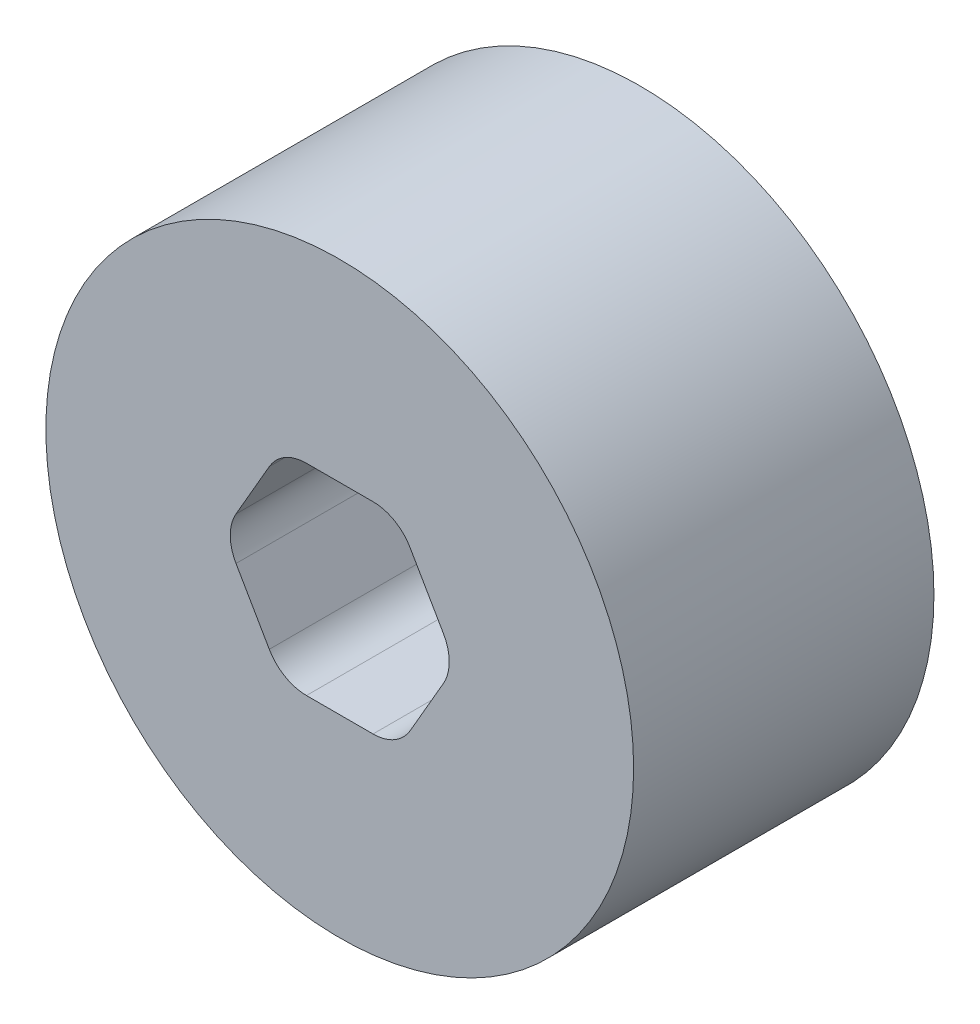
from build123d import *

# Parameters (mm, degrees)
SKETCH1_R           = 17.399
BOSS_EXTRUDE1_DEPTH = 17.78
FILLET1_R           = 2.54


with BuildPart() as part:
    # Sketch1 → Boss-Extrude1 (new body)
    with BuildSketch(Plane.XY):
        Circle(SKETCH1_R)
        Polygon((6.87578, 0), (3.43789, 5.954600151), (-3.43789, 5.954600151), (-6.87578, 0), (-3.43789, -5.954600151), (3.43789, -5.954600151), align=None, mode=Mode.SUBTRACT)
    extrude(amount=BOSS_EXTRUDE1_DEPTH)

    # Fillet1
    fillet1_edges = [part.edges().sort_by_distance(p)[0] for p in [
        (6.87578, 0, 8.89),
        (3.43789, 5.954600151, 8.89),
        (-3.43789, 5.954600151, 8.89),
        (-6.87578, 0, 8.89),
        (-3.43789, -5.954600151, 8.89),
        (3.43789, -5.954600151, 8.89),
    ]]
    fillet(fillet1_edges, radius=FILLET1_R)


solid = part.part
